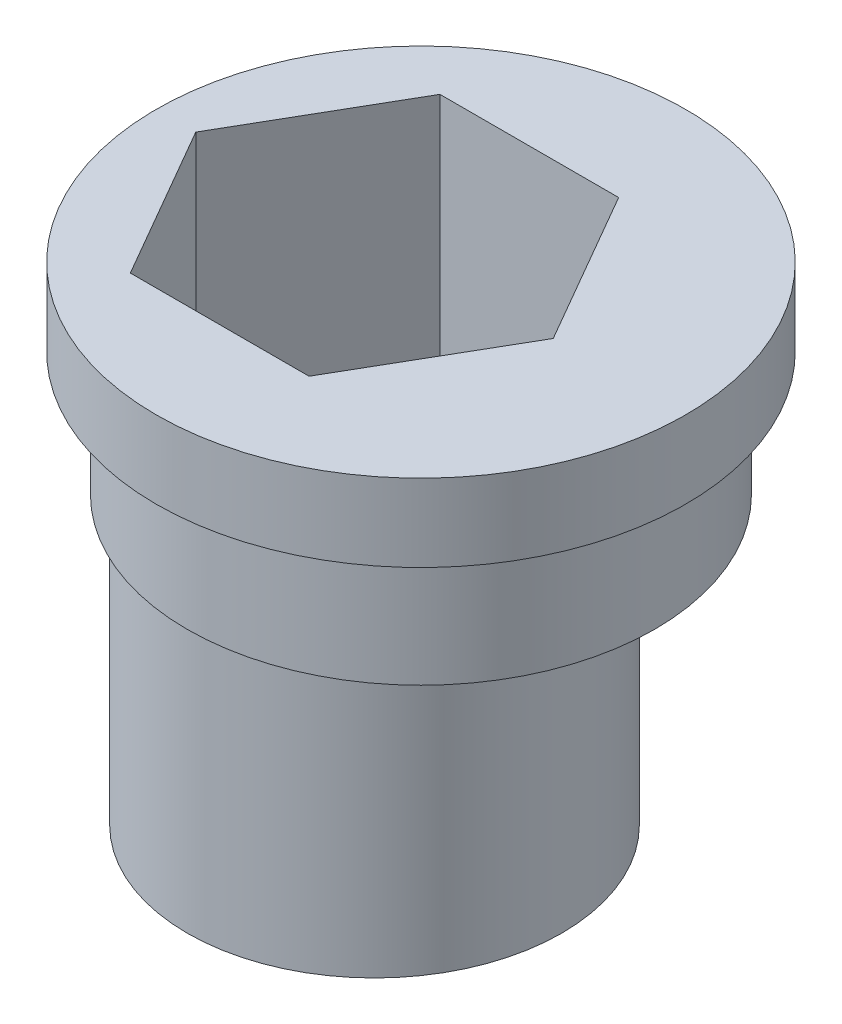
from build123d import *

# Parameters (mm, degrees)
SKETCH1_R           = 6.05
BOSS_EXTRUDE1_DEPTH = 10
SKETCH1_3_R         = 7.55
BOSS_EXTRUDE2_DEPTH = 4
BOSS_EXTRUDE3_START = 4
SKETCH1_5_R         = 8.55
SKETCH1_5_R_2       = 7.55
SKETCH1_5_R_3       = 6.05
BOSS_EXTRUDE3_DEPTH = 2.5


with BuildPart() as part:
    # Sketch1 → Boss-Extrude1 (new body)
    with BuildSketch(Plane(origin=(0, 0, 0), x_dir=(1, 0, 0), z_dir=(0, 1, 0))):
        with Locations(Location((0, 0, 0), (0, 0, 270))):
            Circle(SKETCH1_R)
        Polygon((5.773502692, 0), (2.886751346, 5), (-2.886751346, 5), (-5.773502692, 0), (-2.886751346, -5), (2.886751346, -5), align=None, mode=Mode.SUBTRACT)
    extrude(amount=-BOSS_EXTRUDE1_DEPTH)

    # Sketch1<3> → Boss-Extrude2 (add)
    with BuildSketch(Plane(origin=(0, 0, 0), x_dir=(1, 0, 0), z_dir=(0, 1, 0))):
        with Locations(Location((1.5, 0, 0), (0, 0, 180))):
            Circle(SKETCH1_3_R)
        Polygon((2.886751346, 5), (-2.886751346, 5), (-5.773502692, 0), (-2.886751346, -5), (2.886751346, -5), (5.773502692, 0), align=None, mode=Mode.SUBTRACT)
    extrude(amount=BOSS_EXTRUDE2_DEPTH)

    # Sketch1<5> → Boss-Extrude3 (add)
    # profile 1 of 3: a face of its own
    with BuildSketch(Plane(origin=(0, 0, 0), x_dir=(1, 0, 0), z_dir=(0, 1, 0)).offset(BOSS_EXTRUDE3_START)):
        with Locations(Location((1.5, 0, 0), (0, 0, 270))):
            Circle(SKETCH1_5_R)
        with Locations(Location((1.5, 0, 0), (0, 0, 180))):
            Circle(SKETCH1_5_R_2, mode=Mode.SUBTRACT)
    # profile 2 of 3: a face of its own
    with BuildSketch(Plane(origin=(0, 0, 0), x_dir=(1, 0, 0), z_dir=(0, 1, 0)).offset(BOSS_EXTRUDE3_START)):
        with Locations(Location((1.5, 0, 0), (0, 0, 180))):
            Circle(SKETCH1_5_R_2)
        with Locations(Location((0, 0, 0), (0, 0, 270))):
            Circle(SKETCH1_5_R_3, mode=Mode.SUBTRACT)
    # profile 3 of 3: a face of its own
    with BuildSketch(Plane(origin=(0, 0, 0), x_dir=(1, 0, 0), z_dir=(0, 1, 0)).offset(BOSS_EXTRUDE3_START)):
        with Locations(Location((0, 0, 0), (0, 0, 270))):
            Circle(SKETCH1_5_R_3)
        Polygon((5.773502692, 0), (2.886751346, 5), (-2.886751346, 5), (-5.773502692, 0), (-2.886751346, -5), (2.886751346, -5), align=None, mode=Mode.SUBTRACT)
    extrude(amount=BOSS_EXTRUDE3_DEPTH)


solid = part.part
